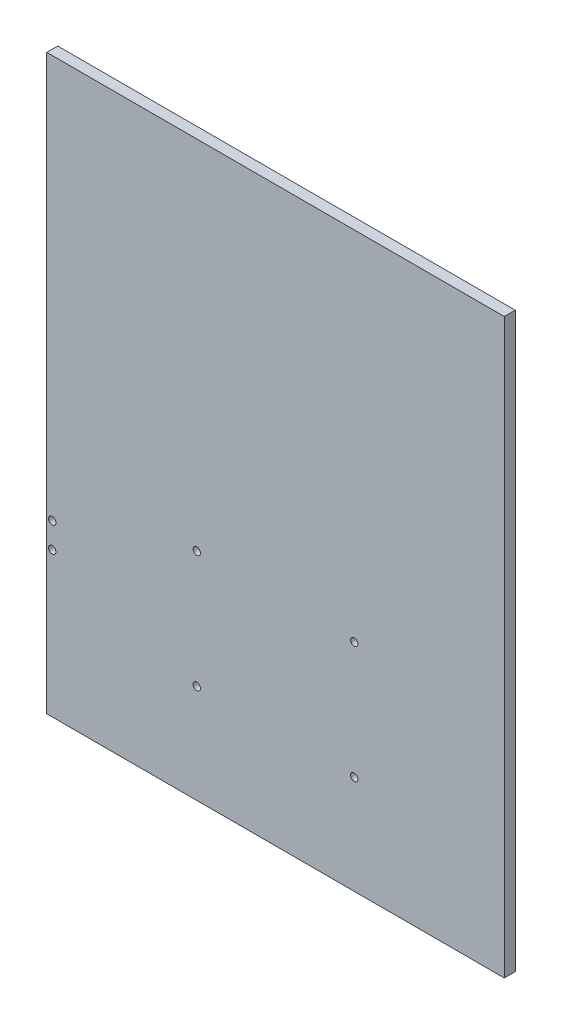
from build123d import *

# Parameters (mm, degrees)
ESQUISSE1_W             = 250
ESQUISSE1_H             = 313
BOSS_EXTRU_1_DEPTH      = 6
ENL_V_MAT_EXTRU_1_REACH = 265.856
ESQUISSE2_R             = 2
ENL_V_MAT_EXTRU_2_REACH = 265.856
ESQUISSE3_R             = 2


with BuildPart() as part:
    # Esquisse1 → Boss.-Extru.1 (new body)
    with BuildSketch(Plane.XY):
        with Locations((-75, -15.5)):
            Rectangle(ESQUISSE1_W, ESQUISSE1_H)
    extrude(amount=BOSS_EXTRU_1_DEPTH)

    # Esquisse2 → Enlèv. mat.-Extru.1 (cut, up to next)
    with BuildSketch(Plane(origin=(0, 0, 0), x_dir=(-1, 0, 0), z_dir=(0, 0, -1)), mode=Mode.PRIVATE) as enl_v_mat_extru_1_sk1:
        with Locations((32, -54)):
            Circle(ESQUISSE2_R)
    enl_v_mat_extru_1_tool1 = extrude(enl_v_mat_extru_1_sk1.sketch, amount=-ENL_V_MAT_EXTRU_1_REACH, mode=Mode.PRIVATE) & part.part
    # Esquisse2 → Enlèv. mat.-Extru.1 (cut, up to next)
    with BuildSketch(Plane(origin=(0, 0, 0), x_dir=(-1, 0, 0), z_dir=(0, 0, -1)), mode=Mode.PRIVATE) as enl_v_mat_extru_1_sk2:
        with Locations((118, -54)):
            Circle(ESQUISSE2_R)
    enl_v_mat_extru_1_tool2 = extrude(enl_v_mat_extru_1_sk2.sketch, amount=-ENL_V_MAT_EXTRU_1_REACH, mode=Mode.PRIVATE) & part.part
    # Esquisse2 → Enlèv. mat.-Extru.1 (cut, up to next)
    with BuildSketch(Plane(origin=(0, 0, 0), x_dir=(-1, 0, 0), z_dir=(0, 0, -1)), mode=Mode.PRIVATE) as enl_v_mat_extru_1_sk3:
        with Locations((118, -118)):
            Circle(ESQUISSE2_R)
    enl_v_mat_extru_1_tool3 = extrude(enl_v_mat_extru_1_sk3.sketch, amount=-ENL_V_MAT_EXTRU_1_REACH, mode=Mode.PRIVATE) & part.part
    # Esquisse2 → Enlèv. mat.-Extru.1 (cut, up to next)
    with BuildSketch(Plane(origin=(0, 0, 0), x_dir=(-1, 0, 0), z_dir=(0, 0, -1)), mode=Mode.PRIVATE) as enl_v_mat_extru_1_sk4:
        with Locations((32, -118)):
            Circle(ESQUISSE2_R)
    enl_v_mat_extru_1_tool4 = extrude(enl_v_mat_extru_1_sk4.sketch, amount=-ENL_V_MAT_EXTRU_1_REACH, mode=Mode.PRIVATE) & part.part
    add(enl_v_mat_extru_1_tool1.solids().sort_by_distance((-32, -54, 0))[0], mode=Mode.SUBTRACT)
    add(enl_v_mat_extru_1_tool2.solids().sort_by_distance((-118, -54, 0))[0], mode=Mode.SUBTRACT)
    add(enl_v_mat_extru_1_tool3.solids().sort_by_distance((-118, -118, 0))[0], mode=Mode.SUBTRACT)
    add(enl_v_mat_extru_1_tool4.solids().sort_by_distance((-32, -118, 0))[0], mode=Mode.SUBTRACT)

    # Esquisse3 → Enlèv. mat.-Extru.2 (cut, up to next)
    with BuildSketch(Plane(origin=(0, 0, 0), x_dir=(-1, 0, 0), z_dir=(0, 0, -1)), mode=Mode.PRIVATE) as enl_v_mat_extru_2_sk1:
        with Locations((197, -79.1)):
            Circle(ESQUISSE3_R)
    enl_v_mat_extru_2_tool1 = extrude(enl_v_mat_extru_2_sk1.sketch, amount=-ENL_V_MAT_EXTRU_2_REACH, mode=Mode.PRIVATE) & part.part
    # Esquisse3 → Enlèv. mat.-Extru.2 (cut, up to next)
    with BuildSketch(Plane(origin=(0, 0, 0), x_dir=(-1, 0, 0), z_dir=(0, 0, -1)), mode=Mode.PRIVATE) as enl_v_mat_extru_2_sk2:
        with Locations((197, -92.9)):
            Circle(ESQUISSE3_R)
    enl_v_mat_extru_2_tool2 = extrude(enl_v_mat_extru_2_sk2.sketch, amount=-ENL_V_MAT_EXTRU_2_REACH, mode=Mode.PRIVATE) & part.part
    add(enl_v_mat_extru_2_tool1.solids().sort_by_distance((-197, -79.1, 0))[0], mode=Mode.SUBTRACT)
    add(enl_v_mat_extru_2_tool2.solids().sort_by_distance((-197, -92.9, 0))[0], mode=Mode.SUBTRACT)


solid = part.part
